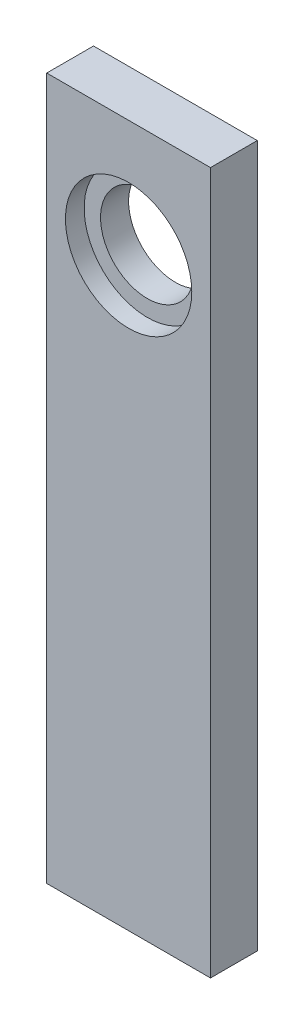
from build123d import *

# Parameters (mm, degrees)
BOSS_EXTRUDE1_DEPTH = 10
SKETCH4_R           = 13.5
CUT_EXTRUDE1_DEPTH  = 4
SKETCH5_R           = 10
CUT_EXTRUDE2_DEPTH  = 127.361584352


with BuildPart() as part:
    # Sketch1 → Boss-Extrude1 (new body)
    with BuildSketch(Plane.XY):
        Polygon((-17.5, 25), (-17.5, 125), (17.5, 125), (17.5, -25), (-17.5, -25), align=None)
    extrude(amount=BOSS_EXTRUDE1_DEPTH)

    # Sketch4 → Cut-Extrude1 (cut)
    with BuildSketch(Plane.XY.offset(10)):
        with Locations((0, 100)):
            Circle(SKETCH4_R)
    extrude(amount=-CUT_EXTRUDE1_DEPTH, mode=Mode.SUBTRACT)

    # Sketch5 → Cut-Extrude2 (cut, through all)
    with BuildSketch(Plane.XY.offset(6)):
        with Locations((0, 100)):
            Circle(SKETCH5_R)
    extrude(amount=-CUT_EXTRUDE2_DEPTH, mode=Mode.SUBTRACT)


solid = part.part
